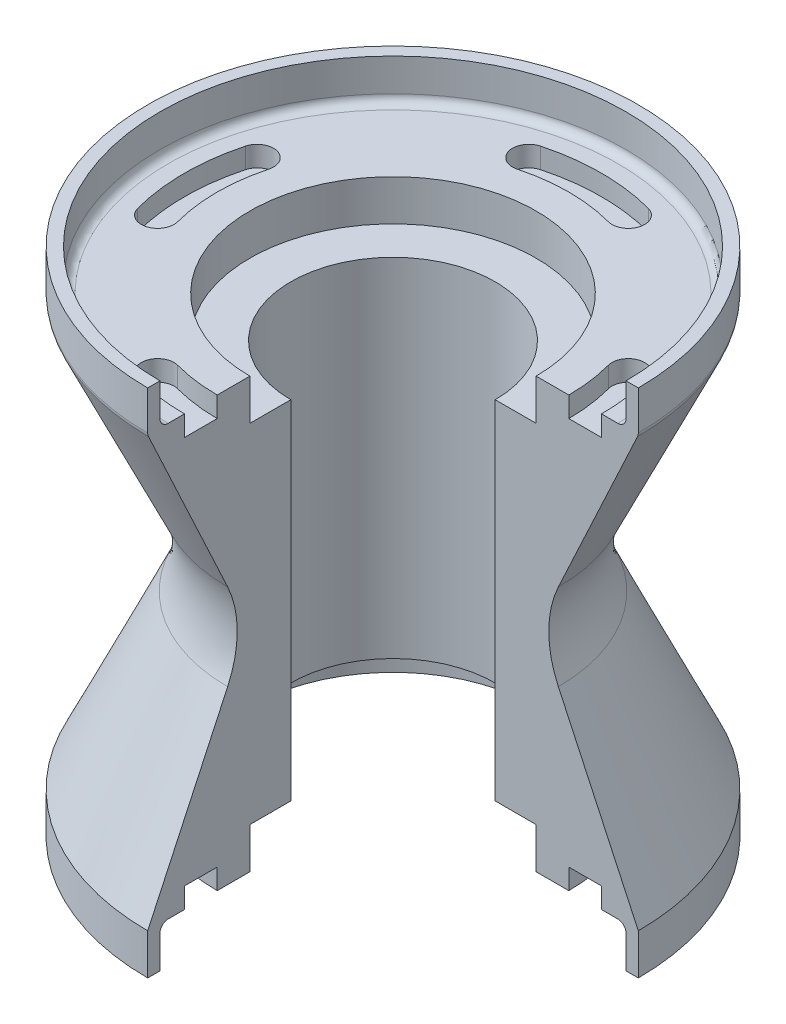
from build123d import *

# Parameters (mm, degrees)
SKETCH1_R               = 60
BOSS_EXTRUDE1_DEPTH     = 52.5
BOSS_EXTRUDE1_TAPER     = 25
CUT_EXTRUDE1_DEPTH      = 136.000000167
CUT_EXTRUDE1_DEPTH_BACK = 136.000000167
SKETCH2_R               = 25
SKETCH3_R               = 35
CUT_EXTRUDE2_DEPTH      = 10
CUT_EXTRUDE5_START      = -10
SKETCH5_R               = 35
CUT_EXTRUDE5_DEPTH      = 10
FILLET1_R               = 25
CUT_EXTRUDE6_DEPTH      = 136.000000167
CUT_EXTRUDE6_DEPTH_BACK = 136.000000167
BOSS_EXTRUDE2_DEPTH     = 10
CUT_EXTRUDE7_DEPTH      = 5
FILLET2_R               = 2
FILLET3_R               = 2


with BuildPart() as part:
    # Sketch1 → Boss-Extrude1 (new body)
    with BuildSketch(Plane(origin=(0, 0, 0), x_dir=(1, 0, 0), z_dir=(0, 1, 0))):
        Circle(SKETCH1_R)
    boss_extrude1 = extrude(amount=BOSS_EXTRUDE1_DEPTH, taper=BOSS_EXTRUDE1_TAPER)

    # Mirror2: Boss-Extrude1 across plane
    add(boss_extrude1.mirror(Plane.ZX.offset(52.5)))

    # Sketch2 → Cut-Extrude1 (cut, two sides: drawn at the far end of the back side and taken through both)
    with BuildSketch(Plane(origin=(0, 105, 0), x_dir=(1, 0, 0), z_dir=(0, 1, 0)).offset(-CUT_EXTRUDE1_DEPTH_BACK)):
        with Locations(Location((0, 0, 0), (0, 0, 270))):
            Circle(SKETCH2_R)
    extrude(amount=CUT_EXTRUDE1_DEPTH + CUT_EXTRUDE1_DEPTH_BACK, mode=Mode.SUBTRACT)

    # Sketch3 → Cut-Extrude2 (cut)
    with BuildSketch(Plane(origin=(0, 105, 0), x_dir=(1, 0, 0), z_dir=(0, 1, 0))):
        with Locations(Location((0, 0, 0), (0, 0, 270))):
            Circle(SKETCH3_R)
    extrude(amount=-CUT_EXTRUDE2_DEPTH, mode=Mode.SUBTRACT)

    # Sketch5 → Cut-Extrude5 (cut)
    with BuildSketch(Plane.XZ.offset(CUT_EXTRUDE5_START)):
        with Locations(Location((0, 0, 0), (0, 0, 90))):
            Circle(SKETCH5_R)
    extrude(amount=CUT_EXTRUDE5_DEPTH, mode=Mode.SUBTRACT)

    # Fillet1
    fillet1_edges = [part.edges().sort_by_distance(p)[0] for p in [
        (-35.518847947, 52.5, 0),
    ]]
    fillet(fillet1_edges, radius=FILLET1_R)

    # Sketch7 → Cut-Extrude6 (cut, two sides: drawn at the far end of the back side and taken through both)
    with BuildSketch(Plane(origin=(0, 105, 0), x_dir=(1, 0, 0), z_dir=(0, 1, 0)).offset(-CUT_EXTRUDE6_DEPTH_BACK)):
        with BuildLine():
            Line((0, -60), (0, 0))
            Line((0, 0), (60, 0))
            ThreePointArc((60, 0), (42.426406871, -42.426406871), (0, -60))
        make_face()
    extrude(amount=CUT_EXTRUDE6_DEPTH + CUT_EXTRUDE6_DEPTH_BACK, mode=Mode.SUBTRACT)

    # Sketch8 → Boss-Extrude2 (add)
    with BuildSketch(Plane.XZ):
        with BuildLine():
            Line((0, 57), (0, 60))
            ThreePointArc((0, 60), (-42.426406871, -42.426406871), (60, 0))
            Line((60, 0), (57, 0))
            ThreePointArc((57, 0), (-40.305086528, -40.305086528), (0, 57))
        make_face()
    boss_extrude2 = extrude(amount=BOSS_EXTRUDE2_DEPTH)

    # Mirror3: Boss-Extrude2 across plane
    add(boss_extrude2.mirror(Plane.ZX.offset(52.5)))

    # Sketch9 → Cut-Extrude7 (cut)
    with BuildSketch(Plane.XZ):
        with BuildLine():
            ThreePointArc((-49.262217141, 13.1997713), (-51, 0), (-49.262217141, -13.1997713))
            ThreePointArc((-49.262217141, -13.1997713), (-44.363237655, -16.028198425), (-41.53481053, -11.129218939))
            ThreePointArc((-41.53481053, -11.129218939), (-43, 0), (-41.53481053, 11.129218939))
            ThreePointArc((-41.53481053, 11.129218939), (-44.363237655, 16.028198425), (-49.262217141, 13.1997713))
        make_face()
        with BuildLine():
            ThreePointArc((11.129218939, 41.53481053), (0, 43), (-11.129218939, 41.53481053))
            ThreePointArc((-11.129218939, 41.53481053), (-16.028198425, 44.363237655), (-13.1997713, 49.262217141))
            ThreePointArc((-13.1997713, 49.262217141), (0, 51), (13.1997713, 49.262217141))
            ThreePointArc((13.1997713, 49.262217141), (16.028198425, 44.363237655), (11.129218939, 41.53481053))
        make_face()
        with BuildLine():
            ThreePointArc((41.53481053, -11.129218939), (43, 0), (41.53481053, 11.129218939))
            ThreePointArc((41.53481053, 11.129218939), (44.363237655, 16.028198425), (49.262217141, 13.1997713))
            ThreePointArc((49.262217141, 13.1997713), (51, 0), (49.262217141, -13.1997713))
            ThreePointArc((49.262217141, -13.1997713), (44.363237655, -16.028198425), (41.53481053, -11.129218939))
        make_face()
        with BuildLine():
            ThreePointArc((-11.129218939, -41.53481053), (0, -43), (11.129218939, -41.53481053))
            ThreePointArc((11.129218939, -41.53481053), (16.028198425, -44.363237655), (13.1997713, -49.262217141))
            ThreePointArc((13.1997713, -49.262217141), (0, -51), (-13.1997713, -49.262217141))
            ThreePointArc((-13.1997713, -49.262217141), (-16.028198425, -44.363237655), (-11.129218939, -41.53481053))
        make_face()
    cut_extrude7 = extrude(amount=-CUT_EXTRUDE7_DEPTH, mode=Mode.SUBTRACT)

    # Mirror4: Cut-Extrude7 across plane
    add(cut_extrude7.mirror(Plane.ZX.offset(52.5)), mode=Mode.SUBTRACT)

    # Fillet2
    fillet2_edges = [part.edges().sort_by_distance(p)[0] for p in [
        (-42.426406871, 105, -42.426406871),
        (-40.305086528, 0, -40.305086528),
    ]]
    fillet(fillet2_edges, radius=FILLET2_R)

    # Fillet3
    fillet3_edges = [part.edges().sort_by_distance(p)[0] for p in [
        (-40.305086528, 105, -40.305086528),
    ]]
    fillet(fillet3_edges, radius=FILLET3_R)


solid = part.part
